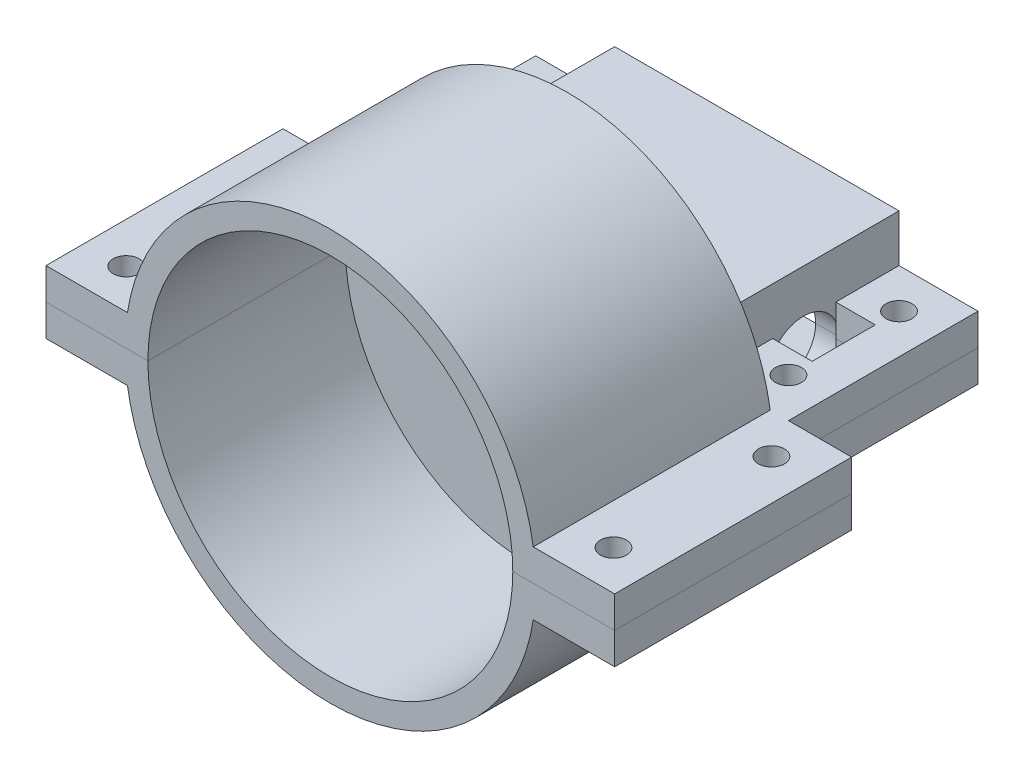
from build123d import *

# Parameters (mm, degrees)
SKETCH_1_R           = 26
SKETCH_1_R_2         = 23.1
EXTRUDE_1_DEPTH      = 25
EXTRUDE_START        = 5
SKETCH_2_R           = 26
EXTRUDE_2_DEPTH      = 5
SKETCH_3_W           = 36
SKETCH_3_H           = 20
SKETCH_3_W_2         = 30.1
SKETCH_3_H_2         = 15.2
EXTRUDE_3_DEPTH      = 24
CUT_EXTRUDE_1_REACH  = 60.762
SKETCH_4_R           = 4.5
EXTRUDE_4_DEPTH      = 4
EXTRUDE_4_DEPTH_BACK = 4
SKETCH_5_W           = 10
SKETCH_5_H           = 24
SKETCH_5_W_2         = 11
SKETCH_5_H_2         = 30
CUT_EXTRUDE_2_REACH  = 57.109
SKETCH_6_R           = 1.65
SKETCH_6_W           = 5
SKETCH_6_H           = 8


with BuildPart() as part:
    # ｽｹｯﾁ1 → ﾎﾞｽ - 押し出し1 (new body)
    with BuildSketch(Plane.XY):
        Circle(SKETCH_1_R)
        Circle(SKETCH_1_R_2, mode=Mode.SUBTRACT)
    extrude(amount=EXTRUDE_1_DEPTH)

    # ｽｹｯﾁ2 → ﾎﾞｽ - 押し出し2 (add)
    with BuildSketch(Plane(origin=(0, 0, 0), x_dir=(-1, 0, 0), z_dir=(0, 0, -1)).offset(EXTRUDE_START)):
        Circle(SKETCH_2_R)
    extrude(amount=-EXTRUDE_2_DEPTH)

    # ｽｹｯﾁ3 → ﾎﾞｽ - 押し出し3 (add)
    with BuildSketch(Plane(origin=(0, 0, -5), x_dir=(-1, 0, 0), z_dir=(0, 0, -1))):
        Rectangle(SKETCH_3_W, SKETCH_3_H)
        Rectangle(SKETCH_3_W_2, SKETCH_3_H_2, mode=Mode.SUBTRACT)
    extrude(amount=EXTRUDE_3_DEPTH)

    # ｶｯﾄ - 押し出し1: up to this face of the body (flat: up to its plane)
    cut_extrude_1_end = Plane(part.part.faces().sort_by_distance((-18, 0, -17))[0])
    # ｽｹｯﾁ4 → ｶｯﾄ - 押し出し1 (cut, up to the picked face)
    with BuildSketch(Plane(origin=(18, 0, 0), x_dir=(0, 0, -1), z_dir=(1, 0, 0)), mode=Mode.PRIVATE) as cut_extrude_1_sk1:
        with Locations((16.9, 0)):
            Circle(SKETCH_4_R)
    cut_extrude_1_tool1 = split(extrude(cut_extrude_1_sk1.sketch, amount=-CUT_EXTRUDE_1_REACH, mode=Mode.PRIVATE), bisect_by=cut_extrude_1_end, keep=Keep.BOTH, mode=Mode.PRIVATE)
    add(cut_extrude_1_tool1.solids().sort_by(Axis((18, 0, -16.9), (-1, 0, 0)))[0], mode=Mode.SUBTRACT)

    # ｽｹｯﾁ5 → ﾎﾞｽ - 押し出し4 (add, two sides: drawn at the far end of the back side and taken through both)
    with BuildSketch(Plane(origin=(0, 0, 0), x_dir=(1, 0, 0), z_dir=(0, 1, 0)).offset(-EXTRUDE_4_DEPTH_BACK)):
        Polygon((28, 5), (25, 5), (25, -25), (36, -25), (36, 5), align=None)
        with Locations((23, 17)):
            Rectangle(SKETCH_5_W, SKETCH_5_H)
        Polygon((-28, 29), (-28, 5), (-25, 5), (-18, 5), (-18, 29), align=None)
        with Locations((-30.5, -10)):
            Rectangle(SKETCH_5_W_2, SKETCH_5_H_2)
    extrude(amount=EXTRUDE_4_DEPTH + EXTRUDE_4_DEPTH_BACK)

    # ｽｹｯﾁ6 → ｶｯﾄ - 押し出し2 (cut, up to next)
    with BuildSketch(Plane(origin=(0, 4, 0), x_dir=(1, 0, 0), z_dir=(0, 1, 0)), mode=Mode.PRIVATE) as cut_extrude_2_sk1:
        with Locations(Location((23, 24, 0), (0, 0, 270))):
            Circle(SKETCH_6_R)
    cut_extrude_2_tool1 = extrude(cut_extrude_2_sk1.sketch, amount=-CUT_EXTRUDE_2_REACH, mode=Mode.PRIVATE) & part.part
    # ｽｹｯﾁ6 → ｶｯﾄ - 押し出し2 (cut, up to next)
    with BuildSketch(Plane(origin=(0, 4, 0), x_dir=(1, 0, 0), z_dir=(0, 1, 0)), mode=Mode.PRIVATE) as cut_extrude_2_sk2:
        with Locations(Location((23, 10, 0), (0, 0, 270))):
            Circle(SKETCH_6_R)
    cut_extrude_2_tool2 = extrude(cut_extrude_2_sk2.sketch, amount=-CUT_EXTRUDE_2_REACH, mode=Mode.PRIVATE) & part.part
    # ｽｹｯﾁ6 → ｶｯﾄ - 押し出し2 (cut, up to next)
    with BuildSketch(Plane(origin=(0, 4, 0), x_dir=(1, 0, 0), z_dir=(0, 1, 0)), mode=Mode.PRIVATE) as cut_extrude_2_sk3:
        with Locations(Location((30.845232579, 0, 0), (0, 0, 270))):
            Circle(SKETCH_6_R)
    cut_extrude_2_tool3 = extrude(cut_extrude_2_sk3.sketch, amount=-CUT_EXTRUDE_2_REACH, mode=Mode.PRIVATE) & part.part
    # ｽｹｯﾁ6 → ｶｯﾄ - 押し出し2 (cut, up to next)
    with BuildSketch(Plane(origin=(0, 4, 0), x_dir=(1, 0, 0), z_dir=(0, 1, 0)), mode=Mode.PRIVATE) as cut_extrude_2_sk4:
        with Locations(Location((30.845232579, -20, 0), (0, 0, 270))):
            Circle(SKETCH_6_R)
    cut_extrude_2_tool4 = extrude(cut_extrude_2_sk4.sketch, amount=-CUT_EXTRUDE_2_REACH, mode=Mode.PRIVATE) & part.part
    # ｽｹｯﾁ6 → ｶｯﾄ - 押し出し2 (cut, up to next)
    with BuildSketch(Plane(origin=(0, 4, 0), x_dir=(1, 0, 0), z_dir=(0, 1, 0)), mode=Mode.PRIVATE) as cut_extrude_2_sk5:
        with Locations(Location((-30.845232579, -20, 0), (0, 0, 270))):
            Circle(SKETCH_6_R)
    cut_extrude_2_tool5 = extrude(cut_extrude_2_sk5.sketch, amount=-CUT_EXTRUDE_2_REACH, mode=Mode.PRIVATE) & part.part
    # ｽｹｯﾁ6 → ｶｯﾄ - 押し出し2 (cut, up to next)
    with BuildSketch(Plane(origin=(0, 4, 0), x_dir=(1, 0, 0), z_dir=(0, 1, 0)), mode=Mode.PRIVATE) as cut_extrude_2_sk6:
        with Locations(Location((-30.845232579, 0, 0), (0, 0, 270))):
            Circle(SKETCH_6_R)
    cut_extrude_2_tool6 = extrude(cut_extrude_2_sk6.sketch, amount=-CUT_EXTRUDE_2_REACH, mode=Mode.PRIVATE) & part.part
    # ｽｹｯﾁ6 → ｶｯﾄ - 押し出し2 (cut, up to next)
    with BuildSketch(Plane(origin=(0, 4, 0), x_dir=(1, 0, 0), z_dir=(0, 1, 0)), mode=Mode.PRIVATE) as cut_extrude_2_sk7:
        with Locations(Location((-23, 10, 0), (0, 0, 270))):
            Circle(SKETCH_6_R)
    cut_extrude_2_tool7 = extrude(cut_extrude_2_sk7.sketch, amount=-CUT_EXTRUDE_2_REACH, mode=Mode.PRIVATE) & part.part
    # ｽｹｯﾁ6 → ｶｯﾄ - 押し出し2 (cut, up to next)
    with BuildSketch(Plane(origin=(0, 4, 0), x_dir=(1, 0, 0), z_dir=(0, 1, 0)), mode=Mode.PRIVATE) as cut_extrude_2_sk8:
        with Locations(Location((-23, 24, 0), (0, 0, 270))):
            Circle(SKETCH_6_R)
    cut_extrude_2_tool8 = extrude(cut_extrude_2_sk8.sketch, amount=-CUT_EXTRUDE_2_REACH, mode=Mode.PRIVATE) & part.part
    # ｽｹｯﾁ6 → ｶｯﾄ - 押し出し2 (cut, up to next)
    with BuildSketch(Plane(origin=(0, 4, 0), x_dir=(1, 0, 0), z_dir=(0, 1, 0)), mode=Mode.PRIVATE) as cut_extrude_2_sk9:
        with Locations((20.5, 17)):
            Rectangle(SKETCH_6_W, SKETCH_6_H)
    cut_extrude_2_tool9 = extrude(cut_extrude_2_sk9.sketch, amount=-CUT_EXTRUDE_2_REACH, mode=Mode.PRIVATE) & part.part
    # ｽｹｯﾁ6 → ｶｯﾄ - 押し出し2 (cut, up to next)
    with BuildSketch(Plane(origin=(0, 4, 0), x_dir=(1, 0, 0), z_dir=(0, 1, 0)), mode=Mode.PRIVATE) as cut_extrude_2_sk10:
        with Locations((-20.5, 17)):
            Rectangle(SKETCH_6_W, SKETCH_6_H)
    cut_extrude_2_tool10 = extrude(cut_extrude_2_sk10.sketch, amount=-CUT_EXTRUDE_2_REACH, mode=Mode.PRIVATE) & part.part
    add(cut_extrude_2_tool1.solids().sort_by_distance((23, 4, -24))[0], mode=Mode.SUBTRACT)
    add(cut_extrude_2_tool2.solids().sort_by_distance((23, 4, -10))[0], mode=Mode.SUBTRACT)
    add(cut_extrude_2_tool3.solids().sort_by_distance((30.845233, 4, 0))[0], mode=Mode.SUBTRACT)
    add(cut_extrude_2_tool4.solids().sort_by_distance((30.845233, 4, 20))[0], mode=Mode.SUBTRACT)
    add(cut_extrude_2_tool5.solids().sort_by_distance((-30.845233, 4, 20))[0], mode=Mode.SUBTRACT)
    add(cut_extrude_2_tool6.solids().sort_by_distance((-30.845233, 4, 0))[0], mode=Mode.SUBTRACT)
    add(cut_extrude_2_tool7.solids().sort_by_distance((-23, 4, -10))[0], mode=Mode.SUBTRACT)
    add(cut_extrude_2_tool8.solids().sort_by_distance((-23, 4, -24))[0], mode=Mode.SUBTRACT)
    add(cut_extrude_2_tool9.solids().sort_by_distance((20.5, 4, -17))[0], mode=Mode.SUBTRACT)
    add(cut_extrude_2_tool10.solids().sort_by_distance((-20.5, 4, -17))[0], mode=Mode.SUBTRACT)


with BuildPart() as body_2:
    # Split Bodies 1: the piece on the far side of the plane
    add(part.part)
    split(bisect_by=Plane.ZX, keep=Keep.BOTTOM)


with BuildPart() as part_1:
    add(part.part)

    # Split Bodies 1
    split(bisect_by=Plane.ZX, keep=Keep.TOP)


solid = Compound([body_2.part, part_1.part])
